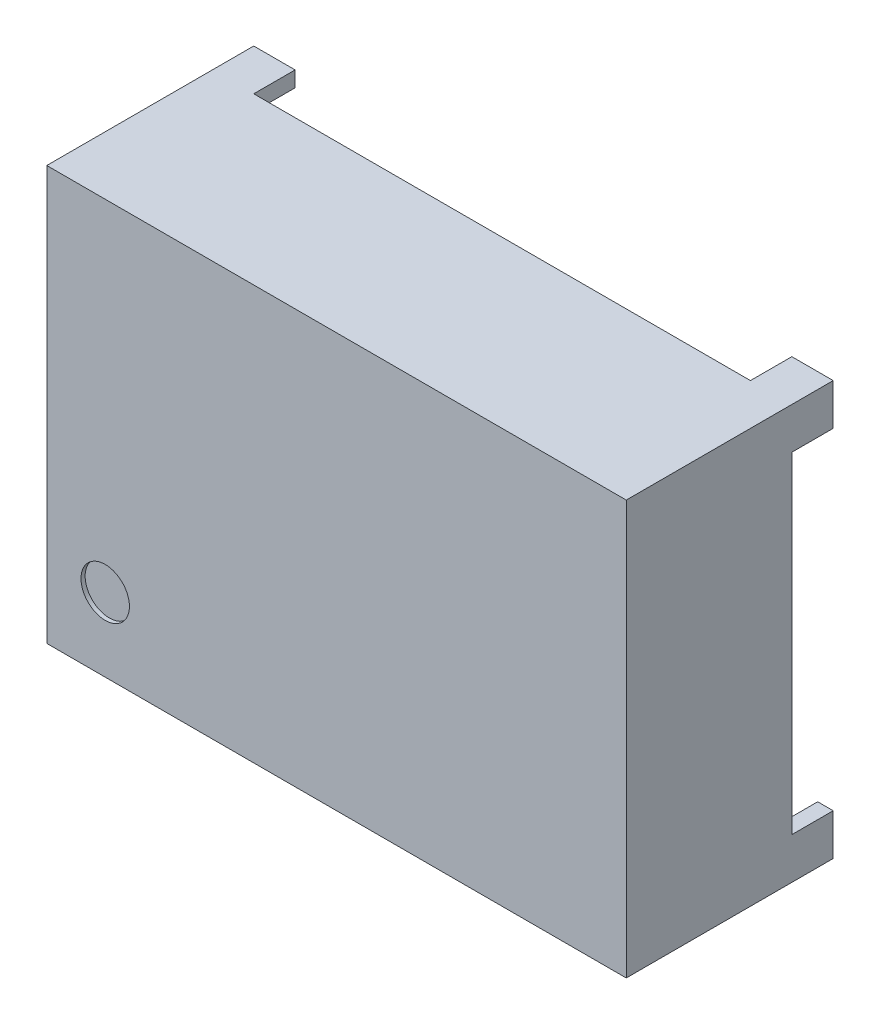
from build123d import *

# Parameters (mm, degrees)
SKETCH_1_W          = 28
SKETCH_1_H          = 20
EXTRUDE_1_DEPTH     = 8
EXTRUDE_2_DEPTH     = 2
SKETCH_3_R          = 1.170120389
CUT_EXTRUDE_1_DEPTH = 0.2


with BuildPart() as part:
    # 草图1 → 拉伸1 (new body)
    with BuildSketch(Plane.XY):
        Rectangle(SKETCH_1_W, SKETCH_1_H)
    extrude(amount=EXTRUDE_1_DEPTH)

    # 草图2 → 拉伸2 (add)
    with BuildSketch(Plane(origin=(0, 0, 0), x_dir=(-1, 0, 0), z_dir=(0, 0, -1))):
        Polygon((-14, 10), (-14, 8), (-13.25, 8), (-13.25, 9.25), (-12, 9.25), (-12, 10), align=None)
        Polygon((12, 10), (14, 10), (14, 8), (13.25, 8), (13.25, 9.25), (12, 9.25), align=None)
        Polygon((-12, -10), (-14, -10), (-14, -8), (-13.25, -8), (-13.25, -9.25), (-12, -9.25), align=None)
        Polygon((14, -10), (14, -8), (13.25, -8), (13.25, -9.25), (12, -9.25), (12, -10), align=None)
    extrude(amount=EXTRUDE_2_DEPTH)

    # 草图3 → 切除-拉伸1 (cut)
    with BuildSketch(Plane.XY.offset(8)):
        with Locations((-11.177269576, -6.453473504)):
            Circle(SKETCH_3_R)
    extrude(amount=-CUT_EXTRUDE_1_DEPTH, mode=Mode.SUBTRACT)


solid = part.part
